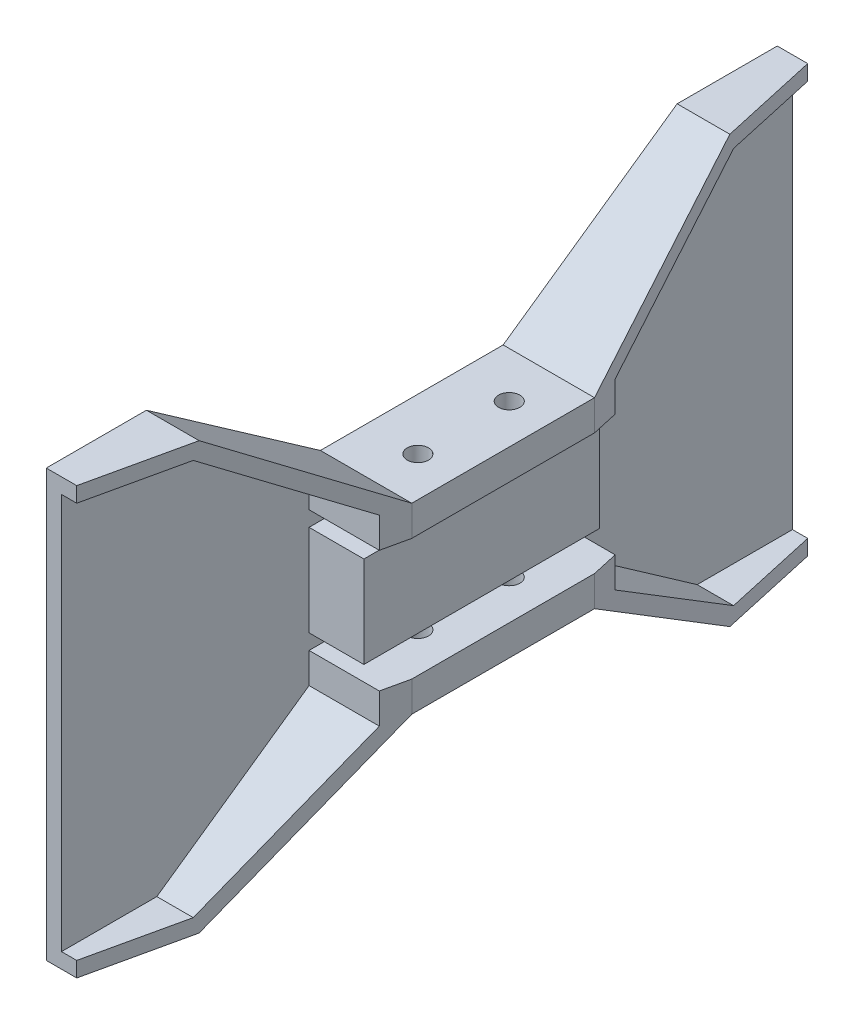
from build123d import *

# Parameters (mm, degrees)
SKETCH1_W           = 19.05
SKETCH1_H           = 49.170887152
BOSS_EXTRUDE1_DEPTH = 6.35
BOSS_EXTRUDE2_START = -6.35
SKETCH1_4_W         = 19.05
SKETCH1_4_H         = 49.170887152
BOSS_EXTRUDE2_DEPTH = 38.1
CUT_EXTRUDE1_START  = 31.75
SKETCH1_6_W         = 19.05
SKETCH1_6_H         = 49.170887152
CUT_EXTRUDE1_DEPTH  = 8.89
SKETCH3_R           = 4.445
CUT_EXTRUDE2_DEPTH  = 180.268046511


with BuildPart() as part:
    # Sketch1 → Boss-Extrude1 (new body)
    with BuildSketch(Plane.YZ):
        Polygon((-19.05, 0), (-25.4, 0), (-25.4, -49.170887152), (-38.1, -49.170887152), (-82.55, -112.652066052), (-82.55, -152.4), (0, -152.4), (0, -49.170887152), (-19.05, -49.170887152), align=None)
        Polygon((-25.4, 0), (-38.1, 0), (-38.1, -38.1), (-88.9, -110.649918742), (-88.9, -152.4), (-82.55, -152.4), (-82.55, -112.652066052), (-38.1, -49.170887152), (-25.4, -49.170887152), align=None)
        with Locations((-9.525, -24.585443576)):
            Rectangle(SKETCH1_W, SKETCH1_H)
    extrude(amount=-BOSS_EXTRUDE1_DEPTH)

    # Sketch1<4> → Boss-Extrude2 (add)
    with BuildSketch(Plane.YZ.offset(BOSS_EXTRUDE2_START)):
        Polygon((-25.4, 0), (-38.1, 0), (-38.1, -38.1), (-88.9, -110.649918742), (-88.9, -152.4), (-82.55, -152.4), (-82.55, -112.652066052), (-38.1, -49.170887152), (-25.4, -49.170887152), align=None)
        with Locations((-9.525, -24.585443576)):
            Rectangle(SKETCH1_4_W, SKETCH1_4_H)
    extrude(amount=BOSS_EXTRUDE2_DEPTH)

    # Sketch1<6> → Cut-Extrude1 (cut)
    with BuildSketch(Plane.YZ.offset(CUT_EXTRUDE1_START)):
        with Locations((-9.525, -24.585443576)):
            Rectangle(SKETCH1_6_W, SKETCH1_6_H)
    extrude(amount=-CUT_EXTRUDE1_DEPTH, mode=Mode.SUBTRACT)

    # Sketch3 → Cut-Extrude2 (cut, through all)
    with BuildSketch(Plane(origin=(0, 0, 0), x_dir=(-1, 0, 0), z_dir=(0, 1, 0))):
        Polygon((-15.182874211, -112.652066052), (-29.289802855, -49.170887152), (-31.75, -49.170887152), (-31.75, -112.652066052), align=None)
        Polygon((-6.35, -152.4), (-15.182874211, -112.652066052), (-31.75, -112.652066052), (-31.75, -152.4), align=None)
        with Locations(Location((-15.24, -19.05, 0), (0, 0, 90))):
            Circle(SKETCH3_R)
        Polygon((-31.75, -38.1), (-31.75, -49.170887152), (-29.289802855, -49.170887152), align=None)
    extrude(amount=-CUT_EXTRUDE2_DEPTH, mode=Mode.SUBTRACT)

    # Mirror1: part across plane


with BuildPart() as part_1:
    add(part.part)
    add(part.part.mirror(Plane(origin=(-6.35, 0, 0), x_dir=(0, 0, 1), z_dir=(0, -1, 0))))

    # Mirror2: part across plane


with BuildPart() as part_2:
    add(part_1.part)
    add(part_1.part.mirror(Plane(origin=(-6.35, 0, 0), x_dir=(1, 0, 0), z_dir=(0, 0, 1))))


solid = part_2.part
